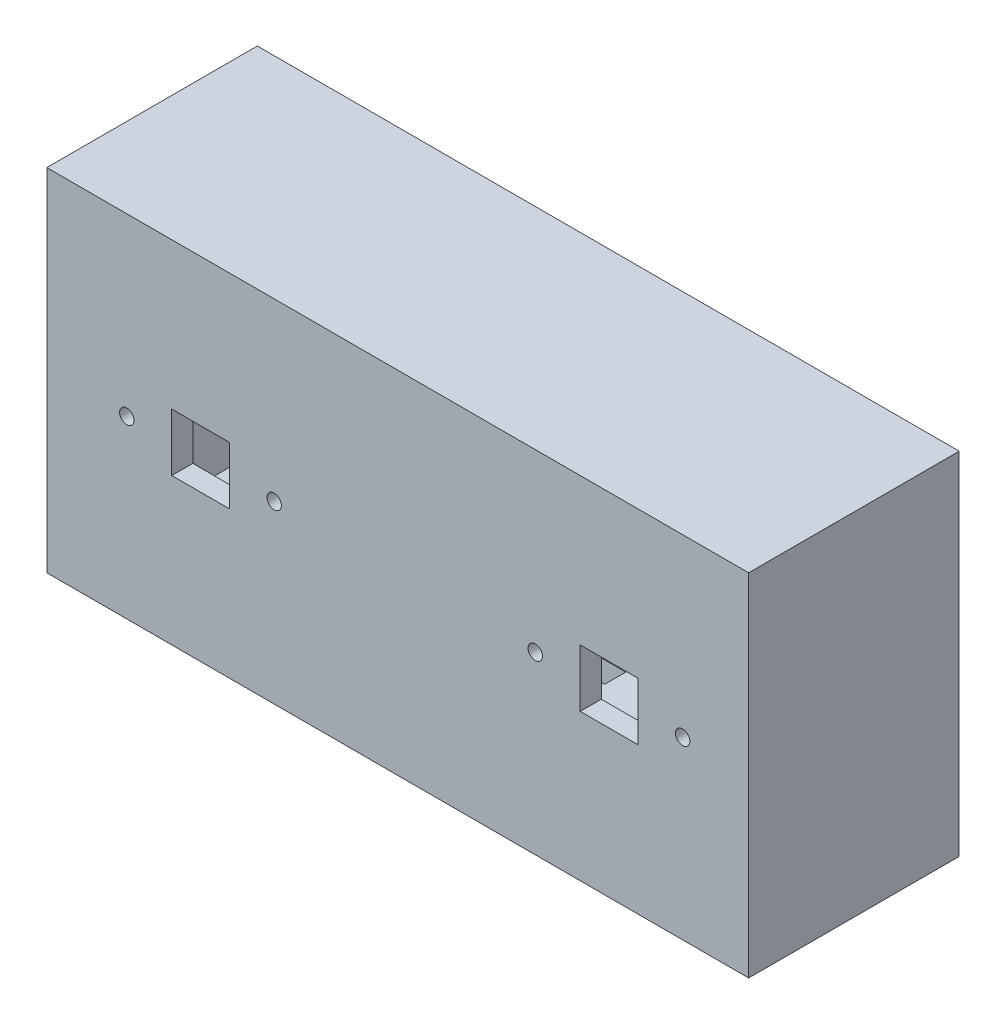
from build123d import *

# Parameters (mm, degrees)
SKETCH1_W                      = 100
SKETCH1_H                      = 30
BOSS_EXTRUDE1_DEPTH            = 50
SHELL1_T                       = -3
CUT_EXTRUDE1_REACH             = 116.495
SKETCH2_W                      = 22.5
SKETCH2_H                      = 12.2
F_2_2_2_2_DIAMETER_HOLE1_D     = 2.2
F_2_2_2_2_DIAMETER_HOLE1_DEPTH = 3
CUT_EXTRUDE2_REACH             = 116.495
SKETCH5_W                      = 15
SKETCH5_H                      = 3
CUT_EXTRUDE3_REACH             = 117.758
SKETCH6_W                      = 8.2
SKETCH6_H                      = 8.2
F_2_05_2_05_DIAMETER_HOLE1_D   = 2.05


with BuildPart() as part:
    # Sketch1 → Boss-Extrude1 (new body)
    with BuildSketch(Plane(origin=(0, 0, 0), x_dir=(1, 0, 0), z_dir=(0, 1, 0))):
        with Locations((50, 15)):
            Rectangle(SKETCH1_W, SKETCH1_H)
    extrude(amount=BOSS_EXTRUDE1_DEPTH)

    # Shell1
    shell1_openings = [part.faces().sort_by_distance(p)[0] for p in [
        (50, 25, -30),
    ]]
    offset(amount=SHELL1_T, openings=shell1_openings, kind=Kind.INTERSECTION)

    # Sketch2 → Cut-Extrude1 (cut, up to next)
    with BuildSketch(Plane(origin=(0, 3, 0), x_dir=(1, 0, 0), z_dir=(0, 1, 0)), mode=Mode.PRIVATE) as cut_extrude1_sk1:
        with Locations((54.15, 12)):
            Rectangle(SKETCH2_W, SKETCH2_H)
    cut_extrude1_tool1 = extrude(cut_extrude1_sk1.sketch, amount=-CUT_EXTRUDE1_REACH, mode=Mode.PRIVATE) & part.part
    add(cut_extrude1_tool1.solids().sort_by_distance((54.15, 3, -12))[0], mode=Mode.SUBTRACT)

    # Ø2.2 (2.2) Diameter Hole1
    with Locations(Plane(origin=(0, 3, 0), x_dir=(1, 0, 0), z_dir=(0, 1, 0))):
        with Locations((68.055, 12), (40.245, 12)):
            Hole(F_2_2_2_2_DIAMETER_HOLE1_D / 2, depth=F_2_2_2_2_DIAMETER_HOLE1_DEPTH)

    # Sketch5 → Cut-Extrude2 (cut, up to next)
    with BuildSketch(Plane(origin=(0, 3, 0), x_dir=(1, 0, 0), z_dir=(0, 1, 0)), mode=Mode.PRIVATE) as cut_extrude2_sk1:
        with Locations((49, 24.5)):
            Rectangle(SKETCH5_W, SKETCH5_H)
    cut_extrude2_tool1 = extrude(cut_extrude2_sk1.sketch, amount=-CUT_EXTRUDE2_REACH, mode=Mode.PRIVATE) & part.part
    add(cut_extrude2_tool1.solids().sort_by_distance((49, 3, -24.5))[0], mode=Mode.SUBTRACT)

    # Sketch6 → Cut-Extrude3 (cut, up to next)
    with BuildSketch(Plane.XY, mode=Mode.PRIVATE) as cut_extrude3_sk1:
        with Locations((80.1, 25)):
            Rectangle(SKETCH6_W, SKETCH6_H)
    cut_extrude3_tool1 = extrude(cut_extrude3_sk1.sketch, amount=-CUT_EXTRUDE3_REACH, mode=Mode.PRIVATE) & part.part
    # Sketch6 → Cut-Extrude3 (cut, up to next)
    with BuildSketch(Plane.XY, mode=Mode.PRIVATE) as cut_extrude3_sk2:
        with Locations((21.9, 25)):
            Rectangle(SKETCH6_W, SKETCH6_H)
    cut_extrude3_tool2 = extrude(cut_extrude3_sk2.sketch, amount=-CUT_EXTRUDE3_REACH, mode=Mode.PRIVATE) & part.part
    add(cut_extrude3_tool1.solids().sort_by_distance((80.1, 25, 0))[0], mode=Mode.SUBTRACT)
    add(cut_extrude3_tool2.solids().sort_by_distance((21.9, 25, 0))[0], mode=Mode.SUBTRACT)

    # Ø2.05 (2.05) Diameter Hole1 (through all)
    with Locations(Plane(origin=(0, 0, -3), x_dir=(-1, 0, 0), z_dir=(0, 0, -1))):
        with Locations((-90.6, 25), (-69.6, 25), (-32.4, 25), (-11.4, 25)):
            Hole(F_2_05_2_05_DIAMETER_HOLE1_D / 2)


solid = part.part
